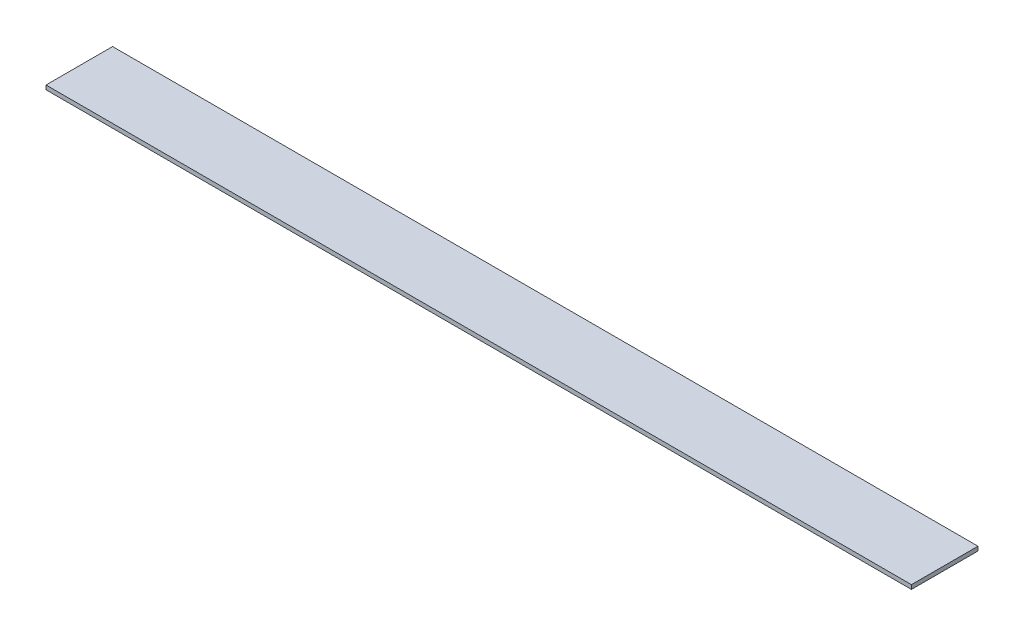
from build123d import *

# Parameters (mm, degrees)
SKETCH1_W           = 330.2
SKETCH1_H           = 25.4
BOSS_EXTRUDE1_DEPTH = 1.5875


with BuildPart() as part:
    # Sketch1 → Boss-Extrude1 (new body)
    with BuildSketch(Plane(origin=(0, 0, 0), x_dir=(1, 0, 0), z_dir=(0, 1, 0))):
        with Locations((165.1, 12.7)):
            Rectangle(SKETCH1_W, SKETCH1_H)
    extrude(amount=BOSS_EXTRUDE1_DEPTH)


solid = part.part
